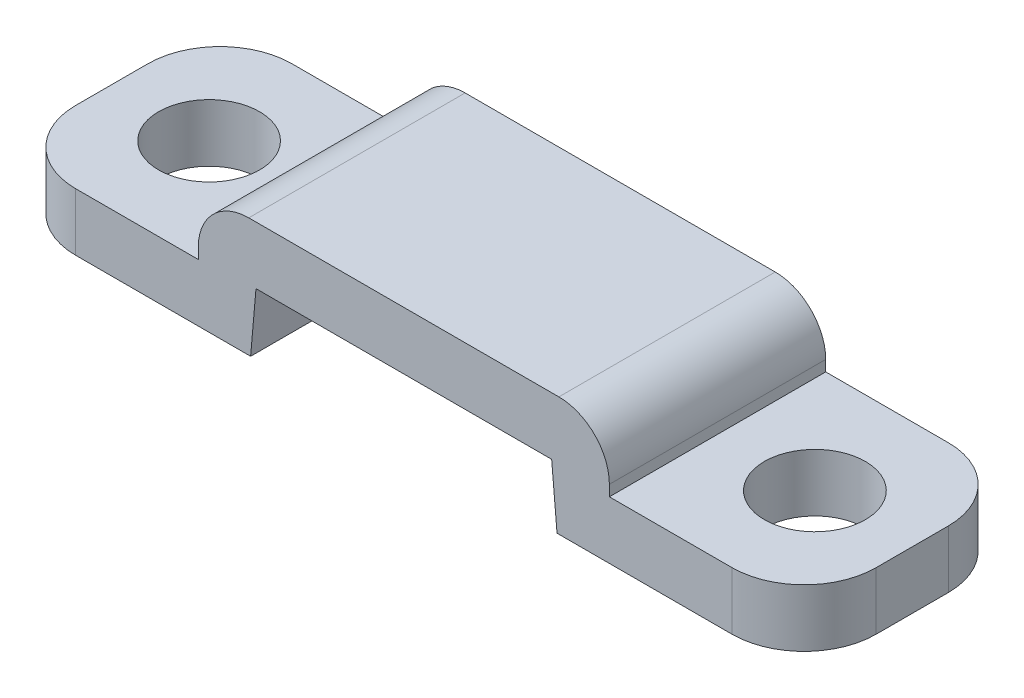
from build123d import *

# Parameters (mm, degrees)
BOSS_EXTRUDE1_DEPTH = 7.62
SKETCH2_R           = 1.778
CUT_EXTRUDE1_DEPTH  = 17.169449279
FILLET1_R           = 2.54
FILLET2_R           = 1.778
DRAFT1_ANGLE        = 5


with BuildPart() as part:
    # Sketch1 → Boss-Extrude1 (new body)
    with BuildSketch(Plane.XY):
        Polygon((-7.239, 0.9525), (-7.239, 3.1115), (7.239, 3.1115), (7.239, 0.9525), (14.097, 0.9525), (14.097, -1.0795), (5.207, -1.0795), (5.207, 1.0795), (-5.207, 1.0795), (-5.207, -1.0795), (-14.097, -1.0795), (-14.097, 0.9525), align=None)
    extrude(amount=BOSS_EXTRUDE1_DEPTH)

    # Sketch2 → Cut-Extrude1 (cut, through all)
    with BuildSketch(Plane(origin=(0, 0.9525, 0), x_dir=(1, 0, 0), z_dir=(0, 1, 0))):
        with Locations(Location((-10.668, -3.81, 0), (0, 0, 180))):
            Circle(SKETCH2_R)
        with Locations(Location((10.668, -3.81, 0), (0, 0, 180))):
            Circle(SKETCH2_R)
    extrude(amount=-CUT_EXTRUDE1_DEPTH, mode=Mode.SUBTRACT)

    # Fillet1
    fillet1_edges = [part.edges().sort_by_distance(p)[0] for p in [
        (-14.097, -0.0635, 0),
        (14.097, -0.0635, 0),
        (-14.097, -0.0635, 7.62),
        (14.097, -0.0635, 7.62),
    ]]
    fillet(fillet1_edges, radius=FILLET1_R)

    # Fillet2
    fillet2_edges = [part.edges().sort_by_distance(p)[0] for p in [
        (-7.239, 3.1115, 3.81),
        (7.239, 3.1115, 3.81),
    ]]
    fillet(fillet2_edges, radius=FILLET2_R)

    # Draft1
    draft1_faces = [part.faces().sort_by_distance(p)[0] for p in [
        (5.207, 0, 3.81),
        (-5.207, 0, 3.81),
    ]]
    draft(draft1_faces, Plane(origin=(-5.207, 1.0795, 7.62), x_dir=(0, 0, -1), z_dir=(0, -1, 0)), DRAFT1_ANGLE)


solid = part.part
